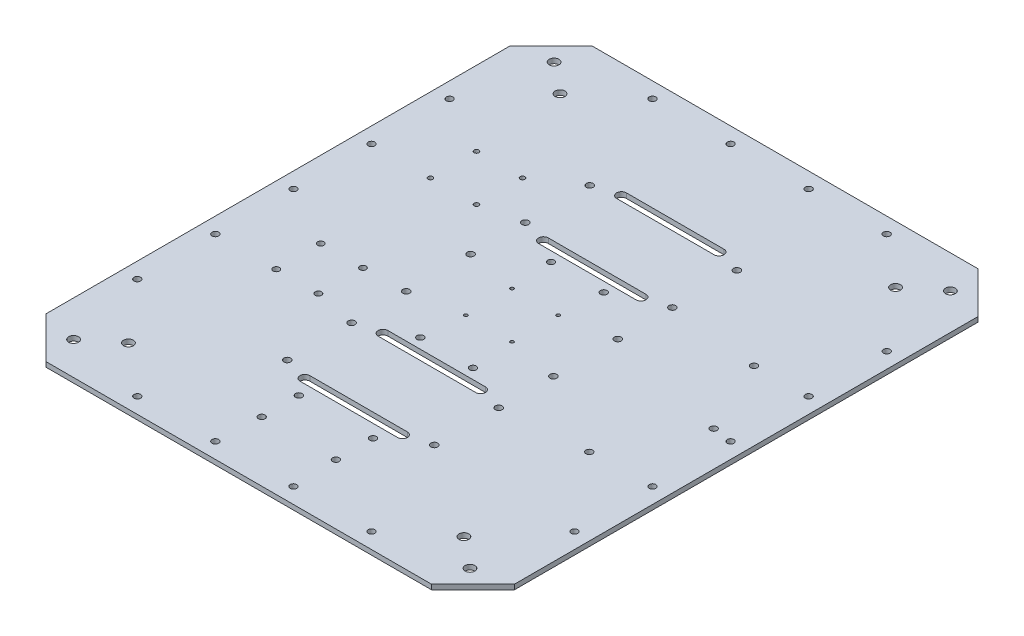
from build123d import *

# Parameters (mm, degrees)
BOSS_EXTRUDE1_DEPTH = 3.175
SKETCH2_R           = 2.159
CUT_EXTRUDE1_DEPTH  = 297.247830215
CUT_EXTRUDE2_DEPTH  = 297.247830215
SKETCH7_R           = 1.524
CUT_EXTRUDE3_DEPTH  = 297.247830215
SKETCH10_R          = 2.159
CUT_EXTRUDE6_DEPTH  = 297.247830215
SKETCH9_R           = 2.032
CUT_EXTRUDE5_DEPTH  = 297.247830215
SKETCH13_R          = 1.1
CUT_EXTRUDE8_DEPTH  = 297.247830215
SKETCH14_R          = 3.175
CUT_EXTRUDE9_DEPTH  = 297.247830215
SKETCH15_R          = 2.159
CUT_EXTRUDE10_DEPTH = 297.247830215
SKETCH16_R          = 2.159
CUT_EXTRUDE11_DEPTH = 297.247830215
SKETCH17_R          = 2.2225
CUT_EXTRUDE13_DEPTH = 297.247830215


with BuildPart() as part:
    # Sketch1 → Boss-Extrude1 (new body)
    with BuildSketch(Plane(origin=(0, 0, 0), x_dir=(1, 0, 0), z_dir=(0, 1, 0))):
        Polygon((-94.345284264, 123.058976948), (-121.286052627, 96.118208585), (-121.286052627, -205.600254688), (-94.345284264, -232.541023052), (156.573179009, -232.541023052), (183.513947373, -205.600254688), (183.513947373, 96.118208585), (156.573179009, 123.058976948), align=None)
    extrude(amount=BOSS_EXTRUDE1_DEPTH)

    # Sketch2 → Cut-Extrude1 (cut, through all)
    with BuildSketch(Plane(origin=(0, 3.175, 0), x_dir=(1, 0, 0), z_dir=(0, 1, 0))):
        with Locations(Location((13.841947373, -12.069023052, 0), (0, 0, 270))):
            Circle(SKETCH2_R)
        with Locations(Location((48.131947373, -12.069023052, 0), (0, 0, 270))):
            Circle(SKETCH2_R)
        with Locations(Location((13.841947373, -97.159023052, 0), (0, 0, 270))):
            Circle(SKETCH2_R)
        with Locations(Location((48.131947373, -97.159023052, 0), (0, 0, 270))):
            Circle(SKETCH2_R)
    extrude(amount=-CUT_EXTRUDE1_DEPTH, mode=Mode.SUBTRACT)

    # Sketch4 → Cut-Extrude2 (cut, through all)
    with BuildSketch(Plane(origin=(0, 3.175, 0), x_dir=(1, 0, 0), z_dir=(0, 1, 0))):
        with BuildLine():
            Line((-0.636052627, 51.430976948), (62.863947373, 51.430976948))
            ThreePointArc((62.863947373, 51.430976948), (66.038947373, 48.255976948), (62.863947373, 45.080976948))
            Line((62.863947373, 45.080976948), (-0.636052627, 45.080976948))
            ThreePointArc((-0.636052627, 45.080976948), (-3.811052627, 48.255976948), (-0.636052627, 51.430976948))
        make_face()
        with BuildLine():
            Line((-0.636052627, 0.630976948), (62.863947373, 0.630976948))
            ThreePointArc((62.863947373, 0.630976948), (66.038947373, -2.544023052), (62.863947373, -5.719023052))
            Line((62.863947373, -5.719023052), (-0.636052627, -5.719023052))
            ThreePointArc((-0.636052627, -5.719023052), (-3.811052627, -2.544023052), (-0.636052627, 0.630976948))
        make_face()
        with BuildLine():
            Line((-0.636052627, -110.113023052), (62.863947373, -110.113023052))
            ThreePointArc((62.863947373, -110.113023052), (66.038947373, -106.938023052), (62.863947373, -103.763023052))
            Line((62.863947373, -103.763023052), (-0.636052627, -103.763023052))
            ThreePointArc((-0.636052627, -103.763023052), (-3.811052627, -106.938023052), (-0.636052627, -110.113023052))
        make_face()
        with BuildLine():
            Line((-0.636052627, -160.913023052), (62.863947373, -160.913023052))
            ThreePointArc((62.863947373, -160.913023052), (66.038947373, -157.738023052), (62.863947373, -154.563023052))
            Line((62.863947373, -154.563023052), (-0.636052627, -154.563023052))
            ThreePointArc((-0.636052627, -154.563023052), (-3.811052627, -157.738023052), (-0.636052627, -160.913023052))
        make_face()
    extrude(amount=-CUT_EXTRUDE2_DEPTH, mode=Mode.SUBTRACT)

    # Sketch7 → Cut-Extrude3 (cut, through all)
    with BuildSketch(Plane(origin=(0, 3.175, 0), x_dir=(1, 0, 0), z_dir=(0, 1, 0))):
        with Locations(Location((-42.800052627, 26.030976948, 0), (0, 0, 270))):
            Circle(SKETCH7_R)
        with Locations(Location((-42.800052627, -3.941023052, 0), (0, 0, 270))):
            Circle(SKETCH7_R)
        with Locations(Location((-72.772052627, -3.941023052, 0), (0, 0, 90))):
            Circle(SKETCH7_R)
        with Locations(Location((-72.772052627, 26.030976948, 0), (0, 0, 90))):
            Circle(SKETCH7_R)
    extrude(amount=-CUT_EXTRUDE3_DEPTH, mode=Mode.SUBTRACT)

    # Sketch10 → Cut-Extrude6 (cut, through all)
    with BuildSketch(Plane.XZ):
        with Locations(Location((6.983947373, 193.475823052, 0), (0, 0, 270))):
            Circle(SKETCH10_R)
        with Locations(Location((55.243947373, 193.475823052, 0), (0, 0, 270))):
            Circle(SKETCH10_R)
        with Locations(Location((6.983947373, 169.345823052, 0), (0, 0, 270))):
            Circle(SKETCH10_R)
        with Locations(Location((55.243947373, 169.345823052, 0), (0, 0, 270))):
            Circle(SKETCH10_R)
    extrude(amount=-CUT_EXTRUDE6_DEPTH, mode=Mode.SUBTRACT)

    # Sketch9 → Cut-Extrude5 (cut, through all)
    with BuildSketch(Plane(origin=(0, 0, 0), x_dir=(-1, 0, 0), z_dir=(0, -1, 0))):
        with Locations(Location((71.502052627, -105.541023052, 0), (0, 0, 90))):
            Circle(SKETCH9_R)
        with Locations(Location((44.070052627, -105.541023052, 0), (0, 0, 270))):
            Circle(SKETCH9_R)
        with Locations(Location((71.502052627, -76.585023052, 0), (0, 0, 90))):
            Circle(SKETCH9_R)
        with Locations(Location((44.070052627, -76.585023052, 0), (0, 0, 270))):
            Circle(SKETCH9_R)
    extrude(amount=-CUT_EXTRUDE5_DEPTH, mode=Mode.SUBTRACT)

    # Sketch13 → Cut-Extrude8 (cut, through all)
    with BuildSketch(Plane.XZ):
        with Locations(Location((16.113947373, 69.741023052, 0), (0, 0, 270))):
            Circle(SKETCH13_R)
        with Locations(Location((16.113947373, 39.741023052, 0), (0, 0, 270))):
            Circle(SKETCH13_R)
        with Locations(Location((46.113947373, 39.741023052, 0), (0, 0, 90))):
            Circle(SKETCH13_R)
        with Locations(Location((46.113947373, 69.741023052, 0), (0, 0, 90))):
            Circle(SKETCH13_R)
    extrude(amount=-CUT_EXTRUDE8_DEPTH, mode=Mode.SUBTRACT)

    # Sketch14 → Cut-Extrude9 (cut, through all)
    with BuildSketch(Plane.XZ):
        with Locations(Location((-97.852656819, 211.073138254, 0), (0, 0, 270))):
            Circle(SKETCH14_R)
        with Locations(Location((-78.044889942, 195.173063684, 0), (0, 0, 270))):
            Circle(SKETCH14_R)
        with Locations(Location((140.272784687, 195.173063684, 0), (0, 0, 90))):
            Circle(SKETCH14_R)
        with Locations(Location((160.080551565, 211.073138254, 0), (0, 0, 90))):
            Circle(SKETCH14_R)
        with Locations(Location((-97.852656819, -101.591092151, 0), (0, 0, 90))):
            Circle(SKETCH14_R)
        with Locations(Location((-78.044889942, -85.691017581, 0), (0, 0, 90))):
            Circle(SKETCH14_R)
        with Locations(Location((160.080551565, -101.591092151, 0), (0, 0, 270))):
            Circle(SKETCH14_R)
        with Locations(Location((140.272784687, -85.691017581, 0), (0, 0, 270))):
            Circle(SKETCH14_R)
    extrude(amount=-CUT_EXTRUDE9_DEPTH, mode=Mode.SUBTRACT)

    # Sketch15 → Cut-Extrude10 (cut, through all)
    with BuildSketch(Plane.XZ):
        with Locations(Location((5.713947373, 222.381023052, 0), (0, 0, 270))):
            Circle(SKETCH15_R)
        with Locations(Location((-45.086052627, 222.381023052, 0), (0, 0, 270))):
            Circle(SKETCH15_R)
        with Locations(Location((-111.126052627, 54.741023052, 0), (0, 0, 270))):
            Circle(SKETCH15_R)
        with Locations(Location((-111.126052627, 105.541023052, 0), (0, 0, 270))):
            Circle(SKETCH15_R)
        with Locations(Location((-111.126052627, 156.341023052, 0), (0, 0, 270))):
            Circle(SKETCH15_R)
        with Locations(Location((173.353947373, 156.341023052, 0), (0, 0, 90))):
            Circle(SKETCH15_R)
        with Locations(Location((173.353947373, 105.541023052, 0), (0, 0, 90))):
            Circle(SKETCH15_R)
        with Locations(Location((173.353947373, 54.741023052, 0), (0, 0, 90))):
            Circle(SKETCH15_R)
        with Locations(Location((107.313947373, 222.381023052, 0), (0, 0, 90))):
            Circle(SKETCH15_R)
        with Locations(Location((56.513947373, 222.381023052, 0), (0, 0, 90))):
            Circle(SKETCH15_R)
        with Locations(Location((56.513947373, -112.898976948, 0), (0, 0, 270))):
            Circle(SKETCH15_R)
        with Locations(Location((107.313947373, -112.898976948, 0), (0, 0, 270))):
            Circle(SKETCH15_R)
        with Locations(Location((173.353947373, 3.941023052, 0), (0, 0, 270))):
            Circle(SKETCH15_R)
        with Locations(Location((173.353947373, -46.858976948, 0), (0, 0, 270))):
            Circle(SKETCH15_R)
        with Locations(Location((-111.126052627, -46.858976948, 0), (0, 0, 90))):
            Circle(SKETCH15_R)
        with Locations(Location((-111.126052627, 3.941023052, 0), (0, 0, 90))):
            Circle(SKETCH15_R)
        with Locations(Location((-45.086052627, -112.898976948, 0), (0, 0, 90))):
            Circle(SKETCH15_R)
        with Locations(Location((5.713947373, -112.898976948, 0), (0, 0, 90))):
            Circle(SKETCH15_R)
    extrude(amount=-CUT_EXTRUDE10_DEPTH, mode=Mode.SUBTRACT)

    # Sketch16 → Cut-Extrude11 (cut, through all)
    with BuildSketch(Plane(origin=(0, 0, 0), x_dir=(-1, 0, 0), z_dir=(0, -1, 0))):
        with Locations(Location((-133.333707373, -106.679409794, 0), (0, 0, 90))):
            Circle(SKETCH16_R)
        with Locations(Location((-138.413707373, -4.529409794, 0), (0, 0, 90))):
            Circle(SKETCH16_R)
        with Locations(Location((-160.653947373, -53.029409794, 0), (0, 0, 90))):
            Circle(SKETCH16_R)
    extrude(amount=-CUT_EXTRUDE11_DEPTH, mode=Mode.SUBTRACT)

    # Sketch17 → Cut-Extrude13 (cut, through all)
    with BuildSketch(Plane(origin=(0, 3.175, 0), x_dir=(1, 0, 0), z_dir=(0, 1, 0))):
        with Locations(Location((78.992947373, -153.166023052, 0), (0, 0, 270))):
            Circle(SKETCH17_R)
        with Locations(Location((-16.765052627, -153.166023052, 0), (0, 0, 270))):
            Circle(SKETCH17_R)
        with Locations(Location((78.992947373, -111.256023052, 0), (0, 0, 270))):
            Circle(SKETCH17_R)
        with Locations(Location((-16.765052627, -111.256023052, 0), (0, 0, 270))):
            Circle(SKETCH17_R)
        with Locations(Location((78.992947373, -75.696023052, 0), (0, 0, 270))):
            Circle(SKETCH17_R)
        with Locations(Location((-16.765052627, -75.696023052, 0), (0, 0, 270))):
            Circle(SKETCH17_R)
        with Locations(Location((78.992947373, -33.786023052, 0), (0, 0, 270))):
            Circle(SKETCH17_R)
        with Locations(Location((-16.765052627, -33.786023052, 0), (0, 0, 270))):
            Circle(SKETCH17_R)
        with Locations(Location((78.992947373, 1.773976948, 0), (0, 0, 270))):
            Circle(SKETCH17_R)
        with Locations(Location((-16.765052627, 1.773976948, 0), (0, 0, 270))):
            Circle(SKETCH17_R)
        with Locations(Location((78.992947373, 43.683976948, 0), (0, 0, 270))):
            Circle(SKETCH17_R)
        with Locations(Location((-16.765052627, 43.683976948, 0), (0, 0, 270))):
            Circle(SKETCH17_R)
    extrude(amount=-CUT_EXTRUDE13_DEPTH, mode=Mode.SUBTRACT)


solid = part.part
